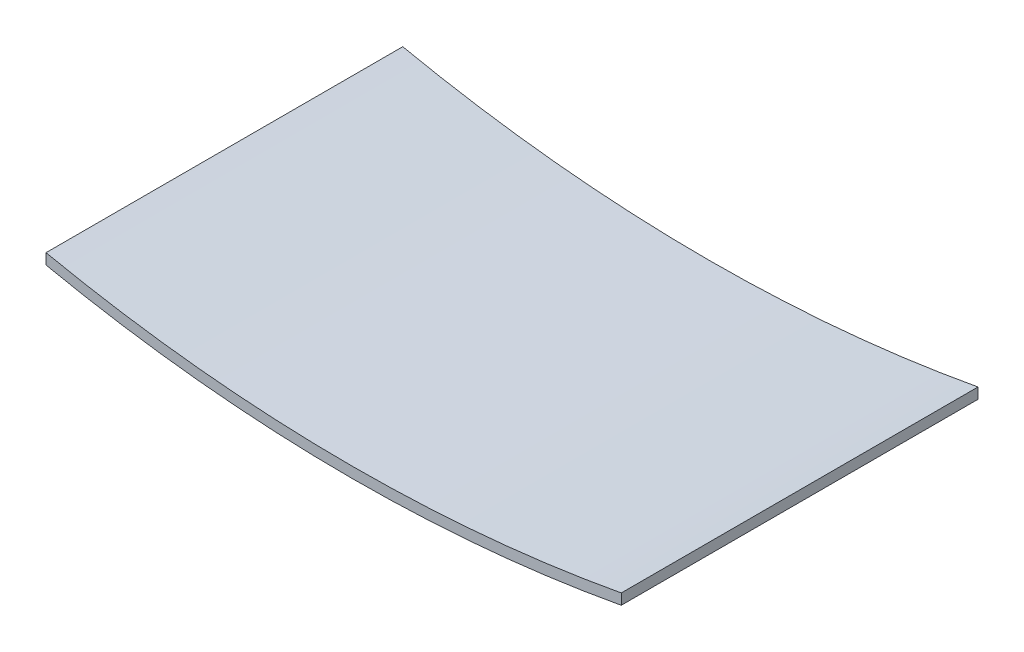
from build123d import *

# Parameters (mm, degrees)
BOSS_EXTRUDE1_DEPTH = 266.7
CUT_EXTRUDE1_DEPTH  = 304.8
SKETCH3_W           = 204.7875
SKETCH3_H           = 6.35
SKETCH3_H_2         = 133.35
CUT_EXTRUDE2_DEPTH  = 60.706


with BuildPart() as part:
    # Sketch1 → Boss-Extrude1 (new body)
    with BuildSketch(Plane.XY):
        with BuildLine():
            Line((204.7875, -2.511386267), (204.7875, -7.591386267))
            ThreePointArc((204.7875, -7.591386267), (102.270785822, -16.362635969), (0, -5.08))
            Line((0, -5.08), (0, 0))
            ThreePointArc((0, 0), (102.270785822, -11.282635969), (204.7875, -2.511386267))
        make_face()
    extrude(amount=BOSS_EXTRUDE1_DEPTH)

    # Sketch2 → Cut-Extrude1 (cut)
    with BuildSketch(Plane(origin=(0, 0, 0), x_dir=(-1, 0, 0), z_dir=(0, 0, -1))):
        with BuildLine():
            ThreePointArc((0, 0), (-102.270785822, -11.282635969), (-204.7875, -2.511386267))
            Line((-204.7875, -2.511386267), (-204.7875, -3.781386267))
            ThreePointArc((-204.7875, -3.781386267), (-102.270785822, -12.552635969), (0, -1.27))
            Line((0, -1.27), (0, 0))
        make_face()
    extrude(amount=-CUT_EXTRUDE1_DEPTH, mode=Mode.SUBTRACT)

    # Sketch3 → Cut-Extrude2 (cut)
    with BuildSketch(Plane(origin=(0, 0, 0), x_dir=(1, 0, 0), z_dir=(0, 1, 0))):
        with Locations((102.39375, -136.525)):
            Rectangle(SKETCH3_W, SKETCH3_H)
        with Locations((102.39375, -66.675)):
            Rectangle(SKETCH3_W, SKETCH3_H_2)
    extrude(amount=-CUT_EXTRUDE2_DEPTH, mode=Mode.SUBTRACT)


solid = part.part
